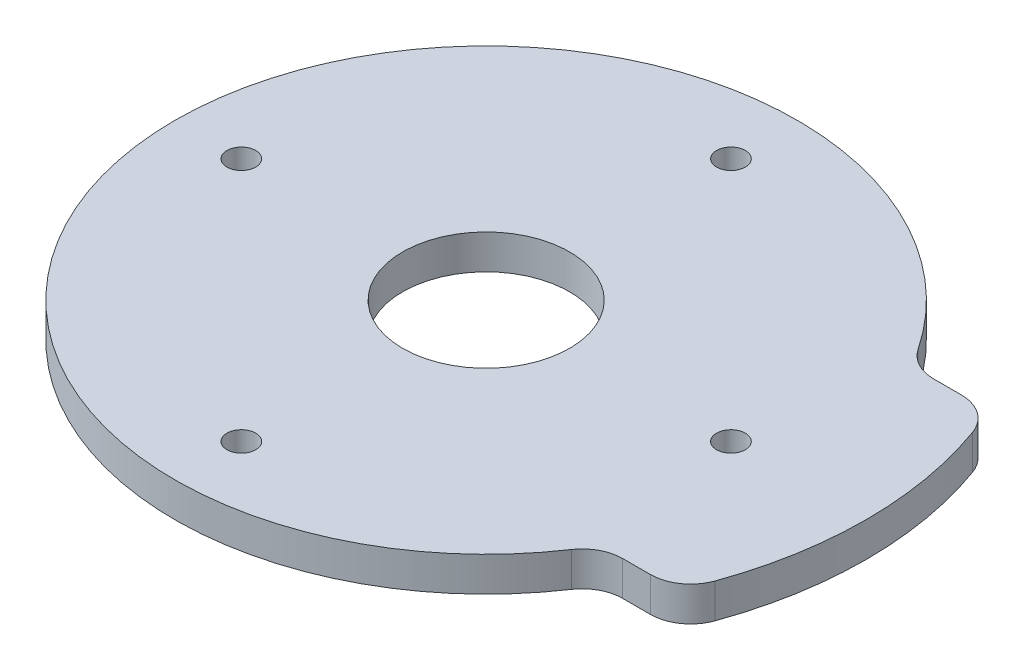
from build123d import *

# Parameters (mm, degrees)
SKETCH_1_R          = 14.5
EXTRUDE_1_DEPTH     = 6
SKETCH_2_R          = 2.5
CUT_EXTRUDE_1_DEPTH = 10
FILLET_1_R          = 7
FILLET_2_R          = 7


with BuildPart() as part:
    # Эскиз1 → Бобышка-Вытянуть1 (new body)
    with BuildSketch(Plane(origin=(0, 0, 0), x_dir=(1, 0, 0), z_dir=(0, 1, 0))):
        with BuildLine():
            Line((60.2245797, -27), (46.823097933, -27))
            ThreePointArc((46.823097933, -27), (-54.05, 0), (46.823097933, 27))
            Line((46.823097933, 27), (60.2245797, 27))
            ThreePointArc((60.2245797, 27), (66, 0), (60.2245797, -27))
        make_face()
        with Locations(Location((0, 0, 0), (0, 0, 270))):
            Circle(SKETCH_1_R, mode=Mode.SUBTRACT)
    extrude(amount=EXTRUDE_1_DEPTH)

    # Эскиз2 → Вырез-Вытянуть1 (cut)
    with BuildSketch(Plane(origin=(0, 6, 0), x_dir=(1, 0, 0), z_dir=(0, 1, 0))):
        with Locations(Location((0, 42.5, 0), (0, 0, 270))):
            Circle(SKETCH_2_R)
        with Locations(Location((0, -42.5, 0), (0, 0, 270))):
            Circle(SKETCH_2_R)
        with Locations(Location((-42.5, 0, 0), (0, 0, 270))):
            Circle(SKETCH_2_R)
        with Locations(Location((42.5, 0, 0), (0, 0, 270))):
            Circle(SKETCH_2_R)
    extrude(amount=-CUT_EXTRUDE_1_DEPTH, mode=Mode.SUBTRACT)

    # Скругление1
    fillet_1_edges = [part.edges().sort_by_distance(p)[0] for p in [
        (60.2245797, 3, -27),
        (60.2245797, 3, 27),
    ]]
    fillet(fillet_1_edges, radius=FILLET_1_R)

    # Скругление2
    fillet_2_edges = [part.edges().sort_by_distance(p)[0] for p in [
        (46.823097933, 3, -27),
        (46.823097933, 3, 27),
    ]]
    fillet(fillet_2_edges, radius=FILLET_2_R)


solid = part.part
